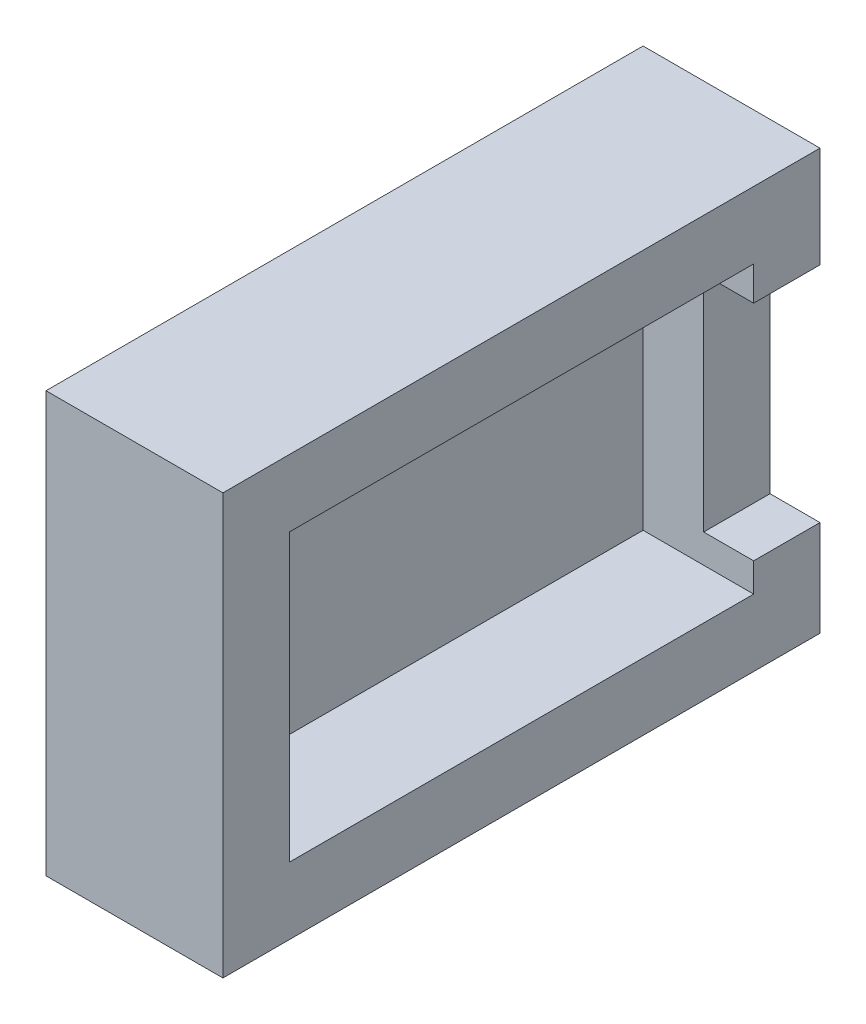
from build123d import *

# Parameters (mm, degrees)
SKETCH1_W           = 27
SKETCH1_H           = 19
BOSS_EXTRUDE1_DEPTH = 3
SKETCH2_W           = 27
SKETCH2_H           = 19
SKETCH2_W_2         = 21
SKETCH2_H_2         = 12.931843368
BOSS_EXTRUDE2_DEPTH = 5
SKETCH3_W           = 2.258281888
SKETCH3_H           = 10.091270109
CUT_EXTRUDE1_DEPTH  = 3


with BuildPart() as part:
    # Sketch1 → Boss-Extrude1 (new body)
    with BuildSketch(Plane(origin=(0, 0, 0), x_dir=(0, 0, -1), z_dir=(1, 0, 0))):
        Rectangle(SKETCH1_W, SKETCH1_H)
    extrude(amount=BOSS_EXTRUDE1_DEPTH)

    # Sketch2 → Boss-Extrude2 (add)
    with BuildSketch(Plane(origin=(3, 0, 0), x_dir=(0, 0, -1), z_dir=(1, 0, 0))):
        Rectangle(SKETCH2_W, SKETCH2_H)
        Rectangle(SKETCH2_W_2, SKETCH2_H_2, mode=Mode.SUBTRACT)
    extrude(amount=BOSS_EXTRUDE2_DEPTH)

    # Sketch3 → Cut-Extrude1 (cut)
    with BuildSketch(Plane(origin=(0, 0, -13.5), x_dir=(-1, 0, 0), z_dir=(0, 0, -1))):
        with Locations((-6.870859056, -0.117113387)):
            Rectangle(SKETCH3_W, SKETCH3_H)
    extrude(amount=-CUT_EXTRUDE1_DEPTH, mode=Mode.SUBTRACT)


solid = part.part
